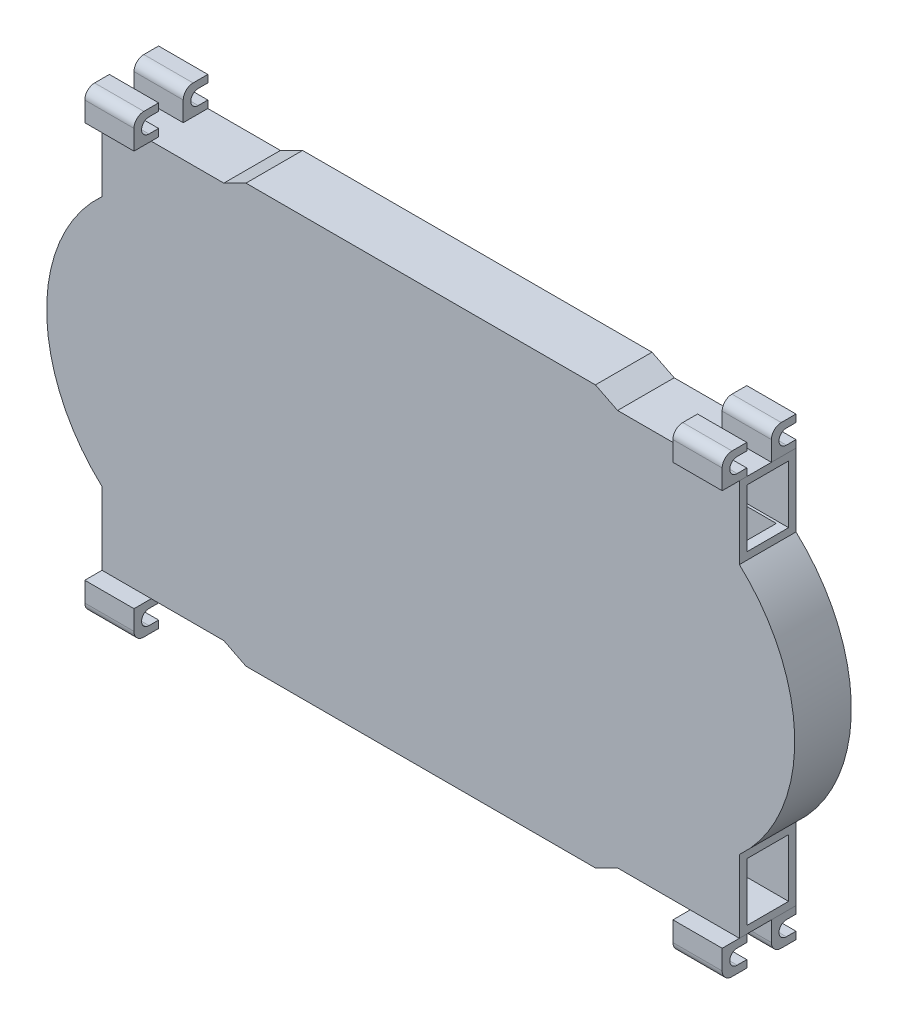
from build123d import *

# Parameters (mm, degrees)
SKETCH_1_W          = 152
SKETCH_1_H          = 85
EXTRUDE_1_DEPTH     = 10
CUT_EXTRUDE_1_DEPTH = 88.648445508
CUT_EXTRUDE_2_DEPTH = 88.648445508
SHELL_1_T           = -2
EXTRUDE_START       = 1.5
EXTRUDE_3_DEPTH     = 1.5
EXTRUDE_2_DEPTH     = 10
EXTRUDE_2_2_DEPTH   = 10
EXTRUDE_2_3_DEPTH   = 10
EXTRUDE_2_4_DEPTH   = 10
SKETCH_6_W          = 8.5
SKETCH_6_H          = 11.75
CUT_EXTRUDE_4_DEPTH = 149.902015097
SKETCH_4_R          = 2.5
CUT_EXTRUDE_3_DEPTH = 3


with BuildPart() as part:
    # 草图1 → 凸台-拉伸1 (new body)
    with BuildSketch(Plane.XY):
        Rectangle(SKETCH_1_W, SKETCH_1_H)
    extrude(amount=EXTRUDE_1_DEPTH)

    # 草图2 → 切除-拉伸1 (cut, through all)
    with BuildSketch(Plane.XY.offset(10)):
        Polygon((-35.5, 42.5), (-40, 40.25), (-76, 40.25), (-76, 42.5), align=None)
        Polygon((76, 42.5), (35.5, 42.5), (40, 40.25), (76, 40.25), align=None)
        Polygon((35.5, -42.5), (40, -40.25), (76, -40.25), (76, -42.5), align=None)
        Polygon((-76, -42.5), (-35.5, -42.5), (-40, -40.25), (-76, -40.25), align=None)
    extrude(amount=-CUT_EXTRUDE_1_DEPTH, mode=Mode.SUBTRACT)

    # 草图3 → 切除-拉伸2 (cut, through all)
    with BuildSketch(Plane.XY.offset(10)):
        with BuildLine():
            Line((-64.75, -25.5), (-64.75, -40.25))
            Line((-64.75, -40.25), (-76, -40.25))
            Line((-76, -40.25), (-76, 40.25))
            Line((-76, 40.25), (-64.75, 40.25))
            Line((-64.75, 40.25), (-64.75, 25.5))
            ThreePointArc((-64.75, 25.5), (-75.99, 0), (-64.75, -25.5))
        make_face()
        with BuildLine():
            Line((64.75, 40.25), (76, 40.25))
            Line((76, 40.25), (76, -40.25))
            Line((76, -40.25), (64.75, -40.25))
            Line((64.75, -40.25), (64.75, -25.5))
            ThreePointArc((64.75, -25.5), (75.99, 0), (64.75, 25.5))
            Line((64.75, 25.5), (64.75, 40.25))
        make_face()
    extrude(amount=-CUT_EXTRUDE_2_DEPTH, mode=Mode.SUBTRACT)

    # 抽壳1
    shell_1_openings = [part.faces().sort_by_distance(p)[0] for p in [
        (0, 0, 10),
    ]]
    offset(amount=SHELL_1_T, openings=shell_1_openings, kind=Kind.INTERSECTION)

    # 草图7 → 凸台-拉伸3 (add)
    with BuildSketch(Plane.XY.offset(10).offset(EXTRUDE_START)):
        with BuildLine():
            Line((-64.75, 40.25), (-40, 40.25))
            Line((-40, 40.25), (-35.5, 42.5))
            Line((-35.5, 42.5), (35.5, 42.5))
            Line((35.5, 42.5), (40, 40.25))
            Line((40, 40.25), (64.75, 40.25))
            Line((64.75, 40.25), (64.75, 25.5))
            ThreePointArc((64.75, 25.5), (75.99, 0), (64.75, -25.5))
            Line((64.75, -25.5), (64.75, -40.25))
            Line((64.75, -40.25), (40, -40.25))
            Line((40, -40.25), (35.5, -42.5))
            Line((35.5, -42.5), (-35.5, -42.5))
            Line((-35.5, -42.5), (-40, -40.25))
            Line((-40, -40.25), (-64.75, -40.25))
            Line((-64.75, -40.25), (-64.75, -25.5))
            ThreePointArc((-64.75, -25.5), (-75.99, 0), (-64.75, 25.5))
            Line((-64.75, 25.5), (-64.75, 40.25))
        make_face()
    extrude(amount=-EXTRUDE_3_DEPTH)


with BuildPart() as body_2:
    # 草图5 → 凸台-拉伸2 (new body)
    with BuildSketch(Plane(origin=(64.75, 0, 0), x_dir=(0, 0, -1), z_dir=(1, 0, 0))):
        with BuildLine():
            Line((0, 40.25), (-5, 40.25))
            Line((-5, 40.25), (-5, 44.25))
            ThreePointArc((-5, 44.25), (-4.414213562, 45.664213562), (-3, 46.25))
            Line((-3, 46.25), (0, 46.25))
            Line((0, 46.25), (0, 44.75))
            Line((0, 44.75), (-1.96025928, 44.75))
            ThreePointArc((-1.96025928, 44.75), (-3.46025928, 43.25), (-1.96025928, 41.75))
            Line((-1.96025928, 41.75), (0, 41.75))
            Line((0, 41.75), (0, 40.25))
        make_face()
    extrude_2 = extrude(amount=-EXTRUDE_2_DEPTH)


with BuildPart() as body_3:
    # 草图5 → Extrude 2 2 (new body)
    with BuildSketch(Plane(origin=(64.75, 0, 0), x_dir=(0, 0, -1), z_dir=(1, 0, 0))):
        with BuildLine():
            Line((-10, 40.25), (-15, 40.25))
            Line((-15, 40.25), (-15, 44.25))
            ThreePointArc((-15, 44.25), (-14.414213562, 45.664213562), (-13, 46.25))
            Line((-13, 46.25), (-10, 46.25))
            Line((-10, 46.25), (-10, 44.75))
            Line((-10, 44.75), (-11.96025928, 44.75))
            ThreePointArc((-11.96025928, 44.75), (-13.46025928, 43.25), (-11.96025928, 41.75))
            Line((-11.96025928, 41.75), (-10, 41.75))
            Line((-10, 41.75), (-10, 40.25))
        make_face()
    extrude_2_2 = extrude(amount=-EXTRUDE_2_2_DEPTH)


with BuildPart() as body_4:
    # 草图5 → Extrude 2 3 (new body)
    with BuildSketch(Plane(origin=(64.75, 0, 0), x_dir=(0, 0, -1), z_dir=(1, 0, 0))):
        with BuildLine():
            Line((-10, -41.75), (-10, -40.25))
            Line((-10, -40.25), (-15, -40.25))
            Line((-15, -40.25), (-15, -44.25))
            ThreePointArc((-15, -44.25), (-14.414213562, -45.664213562), (-13, -46.25))
            Line((-13, -46.25), (-10, -46.25))
            Line((-10, -46.25), (-10, -44.75))
            Line((-10, -44.75), (-11.96025928, -44.75))
            ThreePointArc((-11.96025928, -44.75), (-13.46025928, -43.25), (-11.96025928, -41.75))
            Line((-11.96025928, -41.75), (-10, -41.75))
        make_face()
    extrude_2_3 = extrude(amount=-EXTRUDE_2_3_DEPTH)


with BuildPart() as body_5:
    # 草图5 → Extrude 2 4 (new body)
    with BuildSketch(Plane(origin=(64.75, 0, 0), x_dir=(0, 0, -1), z_dir=(1, 0, 0))):
        with BuildLine():
            Line((0, -41.75), (0, -40.25))
            Line((0, -40.25), (-5, -40.25))
            Line((-5, -40.25), (-5, -44.25))
            ThreePointArc((-5, -44.25), (-4.414213562, -45.664213562), (-3, -46.25))
            Line((-3, -46.25), (0, -46.25))
            Line((0, -46.25), (0, -44.75))
            Line((0, -44.75), (-1.96025928, -44.75))
            ThreePointArc((-1.96025928, -44.75), (-3.46025928, -43.25), (-1.96025928, -41.75))
            Line((-1.96025928, -41.75), (0, -41.75))
        make_face()
    extrude_2_4 = extrude(amount=-EXTRUDE_2_4_DEPTH)


with BuildPart() as part_1:
    add(part.part)

    # 镜向10: 凸台-拉伸2, Extrude 2 2, Extrude 2 3, Extrude 2 4 across plane
    add(extrude_2.mirror(Plane(origin=(0, 0, 0), x_dir=(0, 0, 1), z_dir=(1, 0, 0))))
    add(extrude_2_2.mirror(Plane(origin=(0, 0, 0), x_dir=(0, 0, 1), z_dir=(1, 0, 0))))
    add(extrude_2_3.mirror(Plane(origin=(0, 0, 0), x_dir=(0, 0, 1), z_dir=(1, 0, 0))))
    add(extrude_2_4.mirror(Plane(origin=(0, 0, 0), x_dir=(0, 0, 1), z_dir=(1, 0, 0))))

    # 草图6 → 切除-拉伸4 (cut, through all)
    with BuildSketch(Plane(origin=(64.75, 0, 0), x_dir=(0, 0, -1), z_dir=(1, 0, 0))):
        with Locations((-5.75, -32.875)):
            Rectangle(SKETCH_6_W, SKETCH_6_H)
        with Locations((-5.75, 32.875)):
            Rectangle(SKETCH_6_W, SKETCH_6_H)
    extrude(amount=-CUT_EXTRUDE_4_DEPTH, mode=Mode.SUBTRACT)

    # 草图4 → 切除-拉伸3 (cut)
    with BuildSketch(Plane(origin=(0, 0, 0), x_dir=(-1, 0, 0), z_dir=(0, 0, -1))):
        with Locations((-45, 0)):
            Circle(SKETCH_4_R)
        with Locations(Location((45, 0, 0), (0, 0, 180))):
            Circle(SKETCH_4_R)
    extrude(amount=-CUT_EXTRUDE_3_DEPTH, mode=Mode.SUBTRACT)


solid = Compound([body_2.part, body_3.part, body_4.part, body_5.part, part_1.part])
